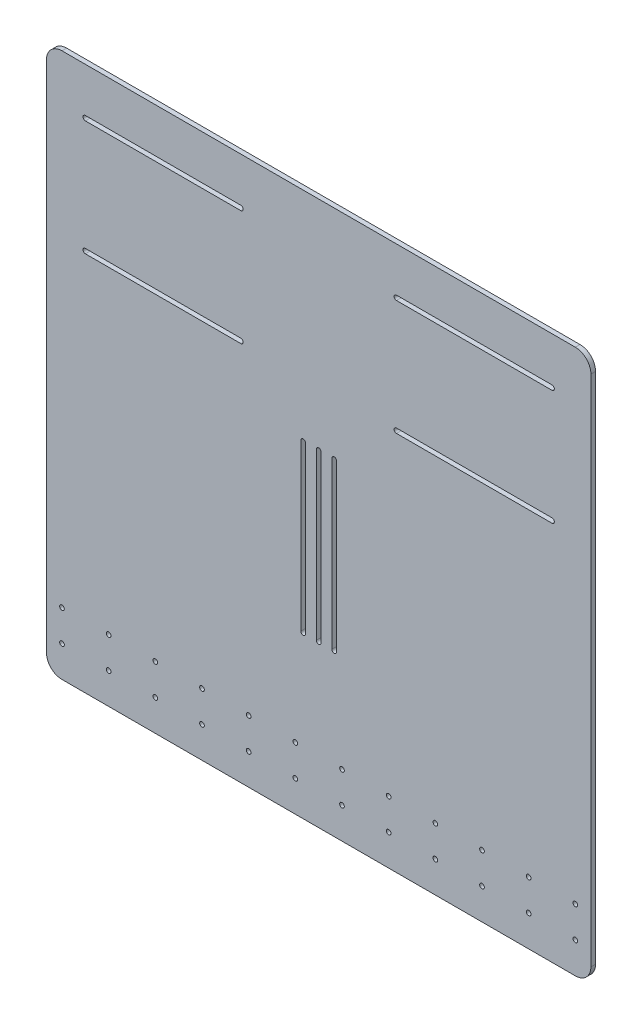
from build123d import *

# Parameters (mm, degrees)
SKETCH_1_R      = 1.5
EXTRUDE_1_DEPTH = 3
FILLET_1_R      = 10


with BuildPart() as part:
    # 草图1 → 凸台-拉伸1 (new body)
    with BuildSketch(Plane.XY):
        Polygon((0, 350), (0, 0), (10, 0), (350, 0), (350, 350), align=None)
        with Locations((10, 20)):
            Circle(SKETCH_1_R, mode=Mode.SUBTRACT)
        with Locations((40, 20)):
            Circle(SKETCH_1_R, mode=Mode.SUBTRACT)
        with Locations((10, 40)):
            Circle(SKETCH_1_R, mode=Mode.SUBTRACT)
        with Locations((40, 40)):
            Circle(SKETCH_1_R, mode=Mode.SUBTRACT)
        with Locations((70, 20)):
            Circle(SKETCH_1_R, mode=Mode.SUBTRACT)
        with Locations((70, 40)):
            Circle(SKETCH_1_R, mode=Mode.SUBTRACT)
        with Locations((100, 20)):
            Circle(SKETCH_1_R, mode=Mode.SUBTRACT)
        with Locations((130, 20)):
            Circle(SKETCH_1_R, mode=Mode.SUBTRACT)
        with Locations((100, 40)):
            Circle(SKETCH_1_R, mode=Mode.SUBTRACT)
        with Locations((130, 40)):
            Circle(SKETCH_1_R, mode=Mode.SUBTRACT)
        with Locations((160, 20)):
            Circle(SKETCH_1_R, mode=Mode.SUBTRACT)
        with Locations((160, 40)):
            Circle(SKETCH_1_R, mode=Mode.SUBTRACT)
        with BuildLine():
            Line((163.5, 103.615907309), (163.5, 210))
            ThreePointArc((163.5, 210), (165, 211.5), (166.5, 210))
            Line((166.5, 210), (166.5, 103.615907309))
            ThreePointArc((166.5, 103.615907309), (165, 102.115907309), (163.5, 103.615907309))
        make_face(mode=Mode.SUBTRACT)
        with Locations((190, 20)):
            Circle(SKETCH_1_R, mode=Mode.SUBTRACT)
        with Locations((190, 40)):
            Circle(SKETCH_1_R, mode=Mode.SUBTRACT)
        with Locations((220, 20)):
            Circle(SKETCH_1_R, mode=Mode.SUBTRACT)
        with Locations((250, 20)):
            Circle(SKETCH_1_R, mode=Mode.SUBTRACT)
        with Locations((220, 40)):
            Circle(SKETCH_1_R, mode=Mode.SUBTRACT)
        with Locations((250, 40)):
            Circle(SKETCH_1_R, mode=Mode.SUBTRACT)
        with Locations((280, 20)):
            Circle(SKETCH_1_R, mode=Mode.SUBTRACT)
        with Locations((280, 40)):
            Circle(SKETCH_1_R, mode=Mode.SUBTRACT)
        with Locations((310, 20)):
            Circle(SKETCH_1_R, mode=Mode.SUBTRACT)
        with Locations((340, 20)):
            Circle(SKETCH_1_R, mode=Mode.SUBTRACT)
        with Locations((310, 40)):
            Circle(SKETCH_1_R, mode=Mode.SUBTRACT)
        with Locations((340, 40)):
            Circle(SKETCH_1_R, mode=Mode.SUBTRACT)
        with BuildLine():
            ThreePointArc((173.5, 210), (175, 211.5), (176.5, 210))
            Line((176.5, 210), (176.5, 103.615907309))
            ThreePointArc((176.5, 103.615907309), (175, 102.115907309), (173.5, 103.615907309))
            Line((173.5, 103.615907309), (173.5, 210))
        make_face(mode=Mode.SUBTRACT)
        with BuildLine():
            ThreePointArc((183.5, 210), (185, 211.5), (186.5, 210))
            Line((186.5, 210), (186.5, 103.615907309))
            ThreePointArc((186.5, 103.615907309), (185, 102.115907309), (183.5, 103.615907309))
            Line((183.5, 103.615907309), (183.5, 210))
        make_face(mode=Mode.SUBTRACT)
        with BuildLine():
            ThreePointArc((25, 244.5), (23.5, 246), (25, 247.5))
            Line((25, 247.5), (125, 247.5))
            ThreePointArc((125, 247.5), (126.5, 246), (125, 244.5))
            Line((125, 244.5), (25, 244.5))
        make_face(mode=Mode.SUBTRACT)
        with BuildLine():
            ThreePointArc((25, 318.5), (23.5, 320), (25, 321.5))
            Line((25, 321.5), (125, 321.5))
            ThreePointArc((125, 321.5), (126.5, 320), (125, 318.5))
            Line((125, 318.5), (25, 318.5))
        make_face(mode=Mode.SUBTRACT)
        with BuildLine():
            Line((225, 247.5), (325, 247.5))
            ThreePointArc((325, 247.5), (326.5, 246), (325, 244.5))
            Line((325, 244.5), (225, 244.5))
            ThreePointArc((225, 244.5), (223.5, 246), (225, 247.5))
        make_face(mode=Mode.SUBTRACT)
        with BuildLine():
            Line((225, 321.5), (325, 321.5))
            ThreePointArc((325, 321.5), (326.5, 320), (325, 318.5))
            Line((325, 318.5), (225, 318.5))
            ThreePointArc((225, 318.5), (223.5, 320), (225, 321.5))
        make_face(mode=Mode.SUBTRACT)
    extrude(amount=EXTRUDE_1_DEPTH)

    # 圆角1
    fillet_1_edges = [part.edges().sort_by_distance(p)[0] for p in [
        (0, 0, 1.5),
        (350, 0, 1.5),
        (0, 350, 1.5),
        (350, 350, 1.5),
    ]]
    fillet(fillet_1_edges, radius=FILLET_1_R)


solid = part.part
